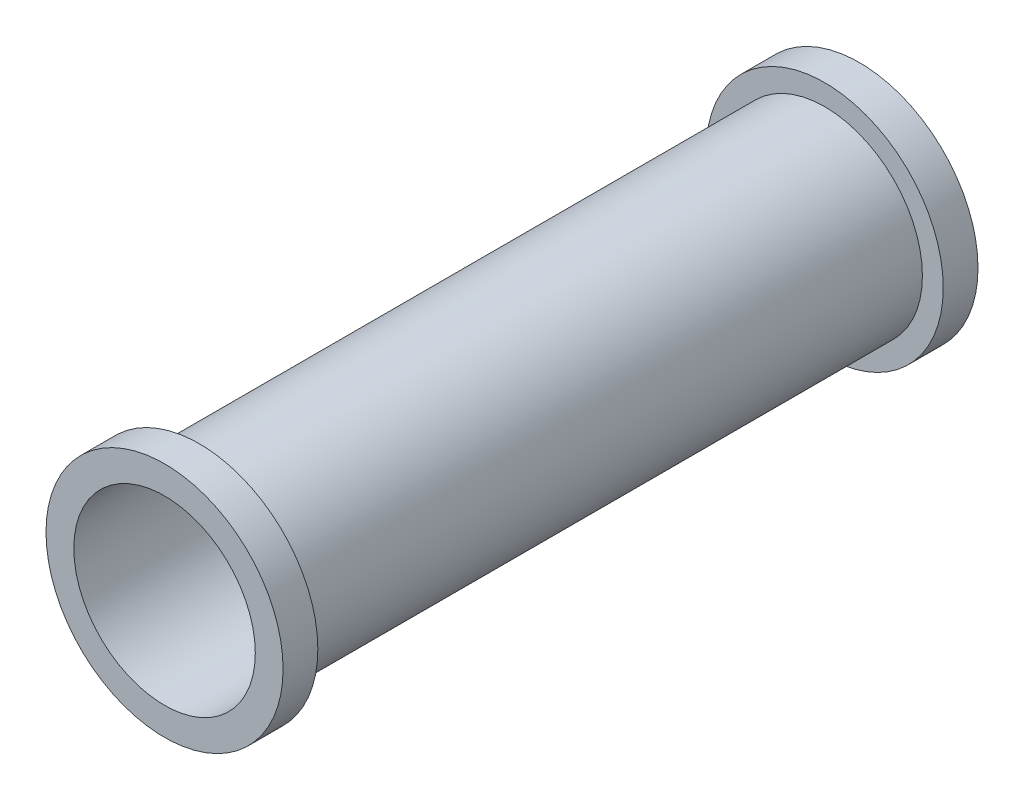
from build123d import *

# Parameters (mm, degrees)
ESQUISSE1_R        = 14.059058324
ESQUISSE1_R_2      = 13.059058324
BOSS_EXTRU_3_DEPTH = 100
ESQUISSE1_6_R      = 17.059058324
ESQUISSE1_6_R_2    = 14.059058324
BOSS_EXTRU_4_DEPTH = 5
BOSS_EXTRU_5_START = -5
ESQUISSE2_R        = 17.059058324
ESQUISSE2_R_2      = 14.059058324
BOSS_EXTRU_5_DEPTH = 5


with BuildPart() as part:
    # Esquisse1 → Boss.-Extru.3 (new body)
    with BuildSketch(Plane.XY):
        Circle(ESQUISSE1_R)
        Circle(ESQUISSE1_R_2, mode=Mode.SUBTRACT)
    extrude(amount=BOSS_EXTRU_3_DEPTH)

    # Esquisse1<6> → Boss.-Extru.4 (add)
    with BuildSketch(Plane.XY):
        Circle(ESQUISSE1_6_R)
        Circle(ESQUISSE1_6_R_2, mode=Mode.SUBTRACT)
    extrude(amount=BOSS_EXTRU_4_DEPTH)

    # Esquisse2 → Boss.-Extru.5 (add)
    with BuildSketch(Plane.XY.offset(100).offset(BOSS_EXTRU_5_START)):
        Circle(ESQUISSE2_R)
        Circle(ESQUISSE2_R_2, mode=Mode.SUBTRACT)
    extrude(amount=BOSS_EXTRU_5_DEPTH)


solid = part.part
